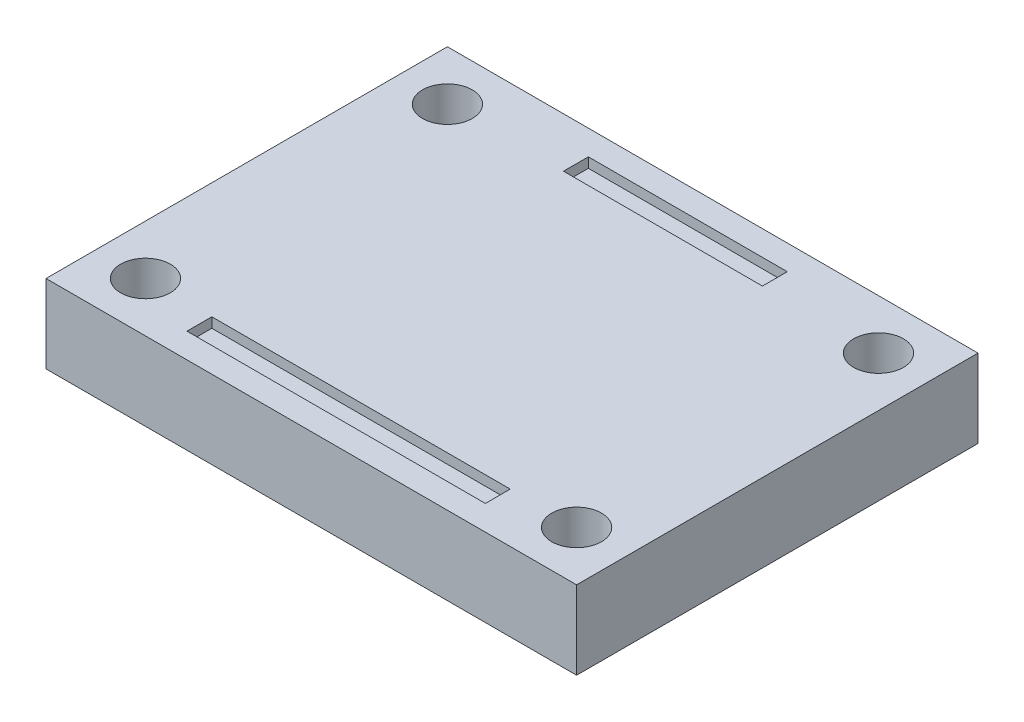
from build123d import *

# Parameters (mm, degrees)
SKETCH1_W           = 27.1
SKETCH1_H           = 20.5
BOSS_EXTRUDE1_DEPTH = 4
SKETCH3_R           = 1.27
CUT_EXTRUDE1_DEPTH  = 35.214909031
SKETCH2_W           = 10.16
SKETCH2_H           = 1.27
SKETCH2_W_2         = 15.24
CUT_EXTRUDE2_DEPTH  = 0.508


with BuildPart() as part:
    # Sketch1 → Boss-Extrude1 (new body)
    with BuildSketch(Plane(origin=(0, 0, 0), x_dir=(1, 0, 0), z_dir=(0, 1, 0))):
        with Locations((13.55, 10.25)):
            Rectangle(SKETCH1_W, SKETCH1_H)
    extrude(amount=BOSS_EXTRUDE1_DEPTH)

    # Sketch3 → Cut-Extrude1 (cut, through all)
    with BuildSketch(Plane(origin=(0, 4, 0), x_dir=(1, 0, 0), z_dir=(0, 1, 0))):
        with Locations(Location((2.54, 17.96, 0), (0, 0, 270))):
            Circle(SKETCH3_R)
        with Locations(Location((2.54, 2.54, 0), (0, 0, 90))):
            Circle(SKETCH3_R)
        with Locations(Location((24.56, 2.54, 0), (0, 0, 270))):
            Circle(SKETCH3_R)
        with Locations(Location((24.56, 17.96, 0), (0, 0, 90))):
            Circle(SKETCH3_R)
    extrude(amount=-CUT_EXTRUDE1_DEPTH, mode=Mode.SUBTRACT)

    # Sketch2 → Cut-Extrude2 (cut)
    with BuildSketch(Plane(origin=(0, 4, 0), x_dir=(1, 0, 0), z_dir=(0, 1, 0))):
        with Locations((13.55, 18.595)):
            Rectangle(SKETCH2_W, SKETCH2_H)
        with Locations((13.55, 1.905)):
            Rectangle(SKETCH2_W_2, SKETCH2_H)
    extrude(amount=-CUT_EXTRUDE2_DEPTH, mode=Mode.SUBTRACT)


solid = part.part
